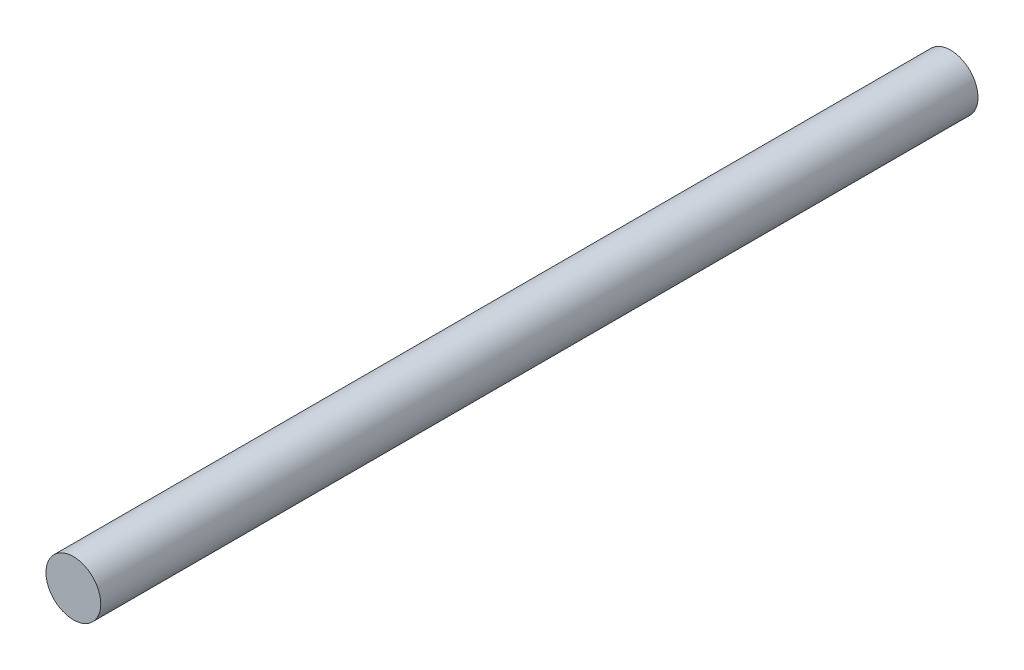
from build123d import *

# Parameters (mm, degrees)
SKETCH2_R           = 1
BOSS_EXTRUDE1_DEPTH = 32


with BuildPart() as part:
    # Sketch2 → Boss-Extrude1 (new body)
    with BuildSketch(Plane.XY):
        with Locations((-21.556411253, 3.490085631)):
            Circle(SKETCH2_R)
    extrude(amount=BOSS_EXTRUDE1_DEPTH)


solid = part.part
